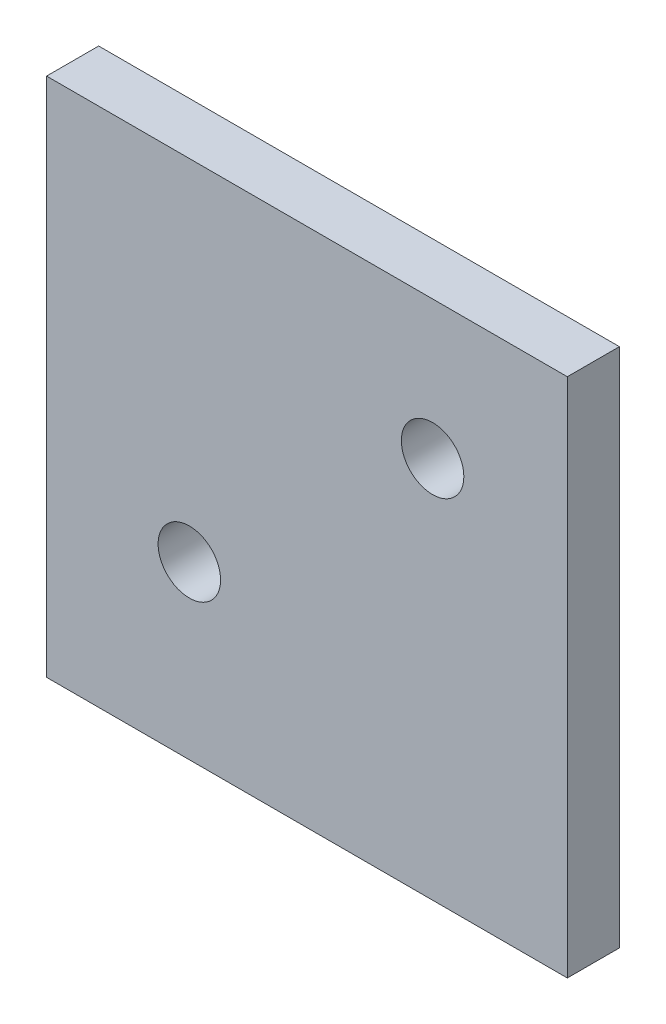
from build123d import *

# Parameters (mm, degrees)
SKETCH_1_W              = 100
SKETCH_1_H              = 100
EXTRUDE_1_DEPTH         = 10
HOLE_WIZARD_12_0_12_1_D = 12


with BuildPart() as part:
    # Эскиз1 → Бобышка-Вытянуть1 (new body)
    with BuildSketch(Plane.XY):
        with Locations((14.962121212, -12.121212121)):
            Rectangle(SKETCH_1_W, SKETCH_1_H)
    extrude(amount=EXTRUDE_1_DEPTH)

    # Диаметр отверстия Ø12.0 (12)1 (through all)
    with Locations(Plane.XY.offset(10)):
        with Locations((39.087457621, 11.331306141), (-7.625345147, -29.230016427)):
            Hole(HOLE_WIZARD_12_0_12_1_D / 2)


solid = part.part
